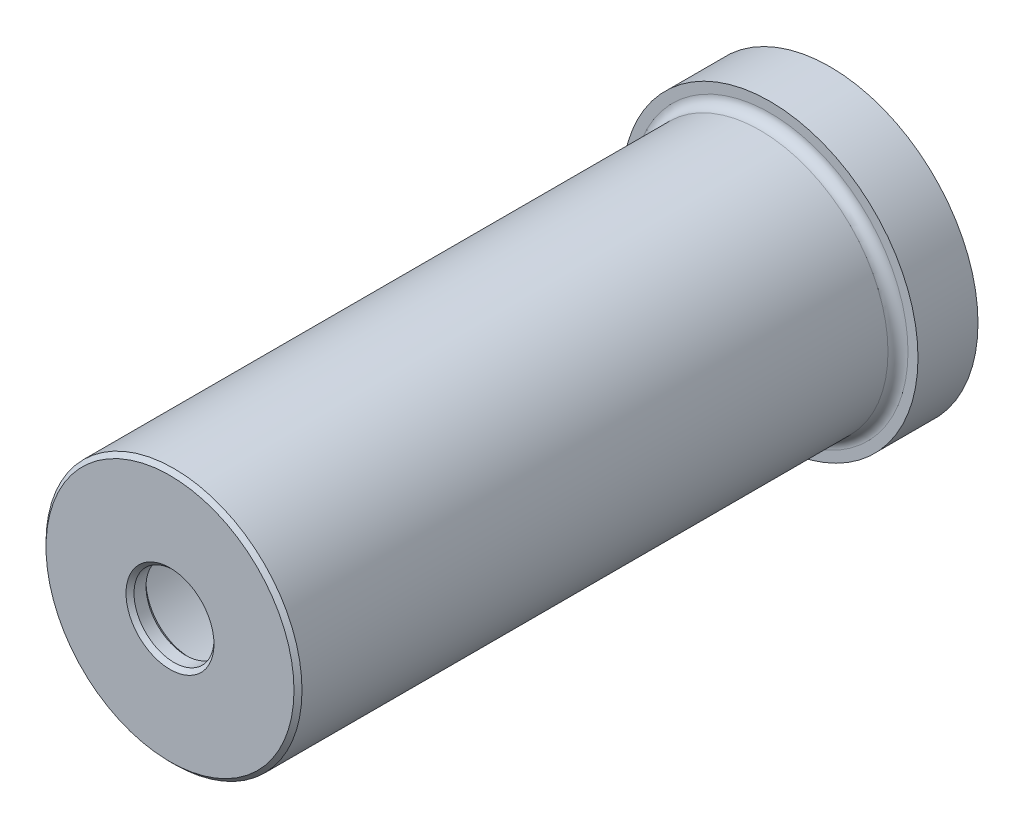
from build123d import *

# Parameters (mm, degrees)
SKETCH1_R      = 74
EXTRUDE1_DEPTH = 30
SKETCH2_R      = 64
EXTRUDE2_DEPTH = 300
SHELL1_T       = -10
FILLET2_R      = 5
CHAMFER2_SIZE  = 2
SKETCH3_R      = 20
EXTRUDE3_DEPTH = 347.196476007
CHAMFER3_SIZE  = 2


with BuildPart() as part:
    # Sketch1 → Extrude1 (new body)
    with BuildSketch(Plane.XY):
        Circle(SKETCH1_R)
    extrude(amount=EXTRUDE1_DEPTH)

    # Sketch2 → Extrude2 (add)
    with BuildSketch(Plane.XY.offset(30)):
        Circle(SKETCH2_R)
    extrude(amount=EXTRUDE2_DEPTH)

    # Shell1
    shell1_openings = [part.faces().sort_by_distance(p)[0] for p in [
        (0, 0, 0),
    ]]
    offset(amount=SHELL1_T, openings=shell1_openings, kind=Kind.INTERSECTION)

    # Fillet2
    fillet2_edges = [part.edges().sort_by_distance(p)[0] for p in [
        (-64, 0, 30),
    ]]
    fillet(fillet2_edges, radius=FILLET2_R)

    # Chamfer2
    chamfer2_edges = [part.edges().sort_by_distance(p)[0] for p in [
        (-64, 0, 330),
    ]]
    chamfer(chamfer2_edges, length=CHAMFER2_SIZE)

    # Sketch3 → Extrude3 (cut, through all)
    with BuildSketch(Plane.XY.offset(330)):
        Circle(SKETCH3_R)
    extrude(amount=-EXTRUDE3_DEPTH, mode=Mode.SUBTRACT)

    # Chamfer3
    chamfer3_edges = [part.edges().sort_by_distance(p)[0] for p in [
        (-20, 0, 320),
        (-20, 0, 330),
    ]]
    chamfer(chamfer3_edges, length=CHAMFER3_SIZE)


solid = part.part
